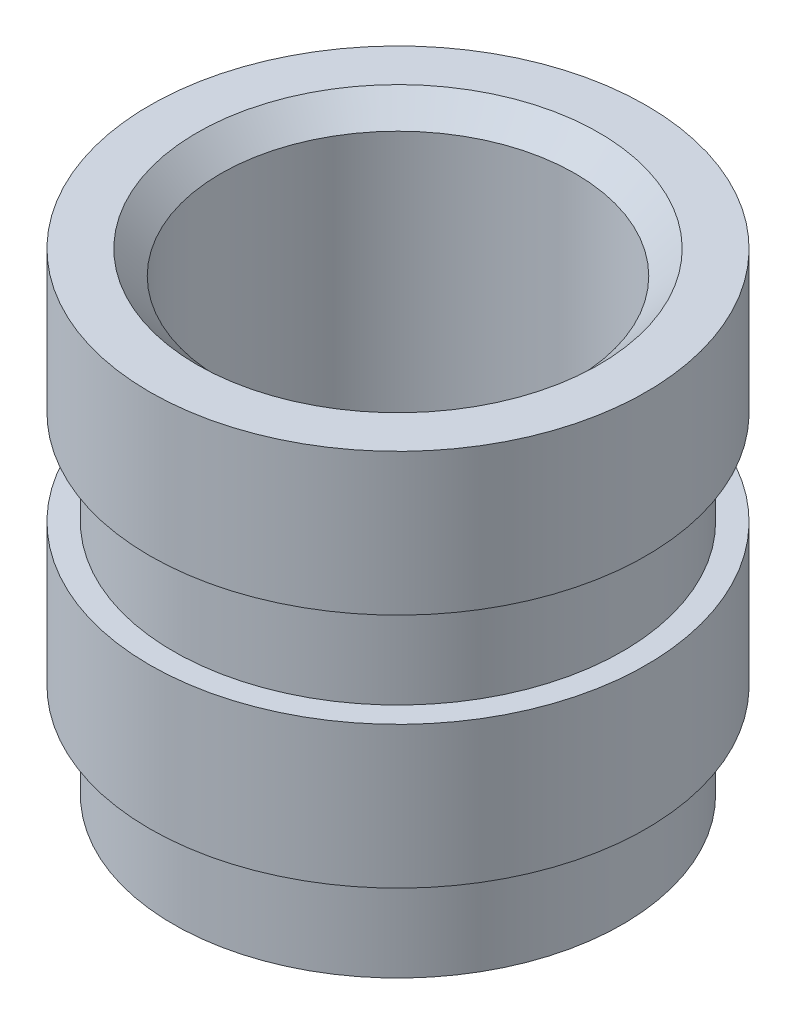
from build123d import *

# Parameters (mm, degrees)
CHAMFER_1_SIZE = 0.2


with BuildPart() as part:
    # 草图1 → 旋转1 (revolve)
    with BuildSketch(Plane.XY, mode=Mode.PRIVATE) as revolve_1_sk:
        Polygon((1.5, 4), (2.1, 4), (2.1, 2.8), (1.9, 2.8), (1.9, 2), (2.1, 2), (2.1, 0.8), (1.9, 0.8), (1.9, 0), (1.5, 0), align=None)
    revolve(revolve_1_sk.sketch.rotate(Axis((0, 0, 0), (0, 1, 0)), 90), axis=Axis((0, 0, 0), (0, 1, 0)))

    # 倒角1
    chamfer_1_edges = [part.edges().sort_by_distance(p)[0] for p in [
        (0, 4, 1.5),
        (0, 0, 1.5),
    ]]
    chamfer(chamfer_1_edges, length=CHAMFER_1_SIZE)


solid = part.part
